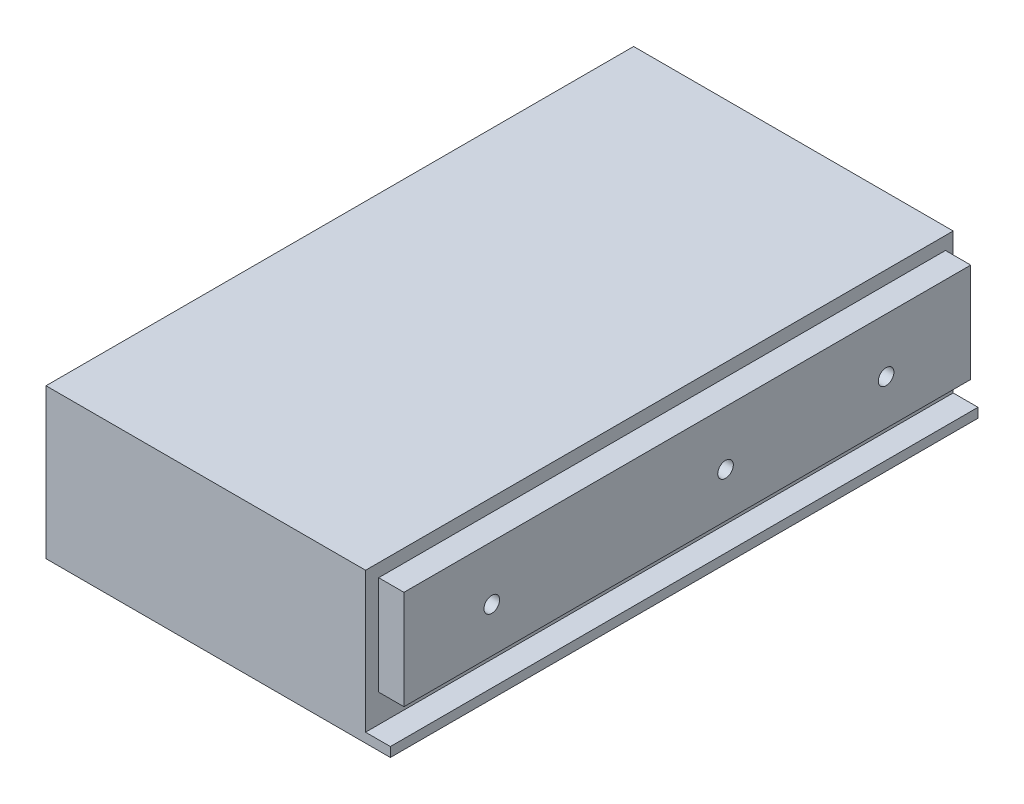
from build123d import *

# Parameters (mm, degrees)
BOSS_EXTRUDE1_DEPTH = 95.6564
SKETCH2_W           = 92.2655
SKETCH2_H           = 16.129
SKETCH2_R           = 1.27
BOSS_EXTRUDE2_DEPTH = 4.1148


with BuildPart() as part:
    # Sketch1 → Boss-Extrude1 (new body)
    with BuildSketch(Plane.XY):
        Polygon((-28.0289, 0), (28.0289, 0), (28.0289, 1.5494), (23.9903, 1.5494), (23.9903, 24.384), (-28.0289, 24.384), align=None)
    extrude(amount=BOSS_EXTRUDE1_DEPTH)

    # Sketch2 → Boss-Extrude2 (add)
    with BuildSketch(Plane(origin=(23.9903, 0, 0), x_dir=(0, 0, -1), z_dir=(1, 0, 0))):
        with Locations((-47.39005, 14.1986)):
            Rectangle(SKETCH2_W, SKETCH2_H)
        with Locations((-79.2226, 13.4239)):
            Circle(SKETCH2_R, mode=Mode.SUBTRACT)
        with Locations((-41.1734, 13.4239)):
            Circle(SKETCH2_R, mode=Mode.SUBTRACT)
        with Locations((-15.0368, 13.4239)):
            Circle(SKETCH2_R, mode=Mode.SUBTRACT)
    extrude(amount=BOSS_EXTRUDE2_DEPTH)


solid = part.part
